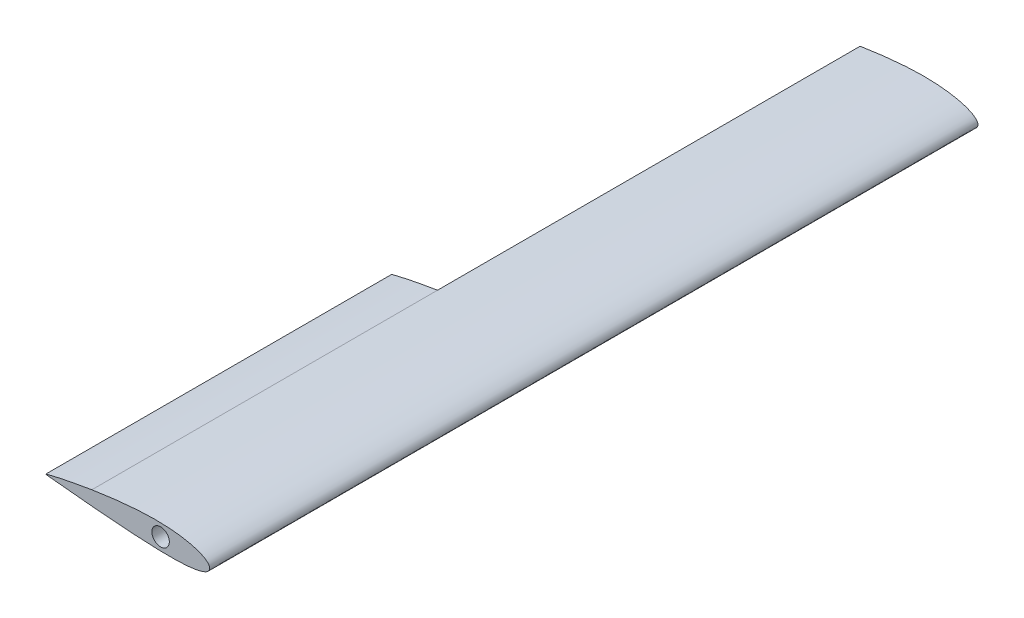
from build123d import *

# Parameters (mm, degrees)
BOSS_EXTRUDE1_DEPTH = 1120
BOSS_EXTRUDE2_DEPTH = 504
SKETCH3_R           = 12.7
CUT_EXTRUDE2_DEPTH  = 800


with BuildPart() as part:
    # Sketch1 → Boss-Extrude1 (new body)
    with BuildSketch(Plane.XY):
        with BuildLine():
            Line((-171.846, 13.802437795), (-171.846, -6.885945817))
            add(Edge.make_bspline(
                [(-171.846, 13.802437795), (-169.687195915, 14.146608219), (-164.597904491, 14.957975772), (-156.487198096, 16.142253603), (-147.460336343, 17.370404658), (-138.251119141, 18.509863587), (-128.91726091, 19.545491819), (-119.516780163, 20.457589719), (-110.108636731, 21.229014604), (-100.738687873, 21.842612064), (-91.448634267, 22.288155063), (-82.295790198, 22.495969861), (-73.354832572, 22.463929008), (-64.702828584, 22.18711462), (-56.397940477, 21.667769113), (-48.495875722, 20.912185856), (-41.049350171, 19.931395959), (-34.10749814, 18.740733947), (-27.715339735, 17.359414779), (-21.913282389, 15.809833244), (-16.73665061, 14.116648387), (-12.215187057, 12.305641332), (-8.372488395, 10.402139974), (-5.225239405, 8.428904048), (-2.783157587, 6.401540541), (-1.052244784, 4.322610537), (-0.056660018, 2.172493692), (0.129841681, -0.013040918), (-0.485118951, -2.116648366), (-1.873876517, -4.027820142), (-3.951712439, -5.73405902), (-6.693728323, -7.267300245), (-10.088688623, -8.637294366), (-14.120806225, -9.844419373), (-18.768065608, -10.885539045), (-24.003355548, -11.757837546), (-29.795659026, -12.460153718), (-36.110844654, -12.993800718), (-42.912190191, -13.362969431), (-50.160721884, -13.574922495), (-57.815433259, -13.639960871), (-65.833426064, -13.571253014), (-74.169986794, -13.384258056), (-82.778692186, -13.096889474), (-91.628583698, -12.725343858), (-100.6830751, -12.294655463), (-109.886493182, -11.766197657), (-119.166555289, -11.162114496), (-128.453974413, -10.498197235), (-137.692554642, -9.790268876), (-146.826066097, -9.052699068), (-155.798515887, -8.297745307), (-164.120854312, -7.576719647), (-169.445500495, -7.10059578), (-171.846, -6.885945817)],
                knots=[0, 0, 0, 0, 0.018424224, 0.043434346, 0.069080412, 0.095203092, 0.121640117, 0.148227444, 0.17480049, 0.201195447, 0.227363977, 0.253181792, 0.278347264, 0.302710399, 0.326128333, 0.348466602, 0.369600377, 0.389415723, 0.407811011, 0.424698681, 0.44000774, 0.453687637, 0.465714725, 0.476103672, 0.484928355, 0.492360154, 0.498730164, 0.504586951, 0.510443348, 0.516803825, 0.524198712, 0.532940661, 0.543185695, 0.554995644, 0.568376342, 0.583298542, 0.599709376, 0.617538825, 0.636703502, 0.65710892, 0.678650912, 0.701216586, 0.724685048, 0.748928058, 0.7738107, 0.799337901, 0.825325561, 0.851504471, 0.877716004, 0.903800001, 0.929595993, 0.954944401, 0.979687675, 1, 1, 1, 1], degree=3))
        make_face()
    extrude(amount=-BOSS_EXTRUDE1_DEPTH)

    # Sketch2 → Boss-Extrude2 (add)
    with BuildSketch(Plane.XY):
        with BuildLine():
            Line((-171.846, 13.802437795), (-171.846, -6.885945817))
            add(Edge.make_bspline(
                [(-171.846, -6.885945817), (-172.279902363, -6.847380871), (-175.440788036, -6.566443507), (-181.20260448, -6.039037107), (-188.990475627, -5.318490675), (-196.354667503, -4.624027661), (-203.248715472, -3.963662315), (-209.62869157, -3.342827921), (-215.45375872, -2.767227992), (-220.68642467, -2.242557883), (-225.292785955, -1.773651923), (-229.242958682, -1.367494105), (-232.510834877, -1.023880311), (-235.075678546, -0.760955177), (-236.918777596, -0.548714441), (-238.031628616, -0.459131063), (-238.533564191, -0.37457711), (-238.666663293, -0.375050863), (-238.675, -0.375080537)],
                knots=[0, 0, 0, 0, 0.019462551, 0.14178051, 0.258505433, 0.368899529, 0.472261554, 0.567931303, 0.655293986, 0.733784513, 0.802891701, 0.862162346, 0.911205133, 0.949694244, 0.977372582, 0.994054454, 0.999627599, 1, 1, 1, 1], degree=3))
            Line((-238.675, -0.375080537), (-238.675, 0.381187438))
            add(Edge.make_bspline(
                [(-171.846, 13.802437795), (-172.525257616, 13.696039939), (-175.933119288, 13.16223779), (-181.929700077, 12.142616472), (-189.692578637, 10.773435489), (-197.014829139, 9.410068419), (-203.853725709, 8.079803357), (-210.168184203, 6.800314366), (-215.920853202, 5.591321475), (-221.077844696, 4.471475693), (-225.608999658, 3.458736193), (-229.487989982, 2.569844783), (-232.692417395, 1.819938124), (-235.203893788, 1.222163617), (-237.008061317, 0.787162185), (-238.08635023, 0.525005253), (-238.562115977, 0.408767052), (-238.675, 0.381187438)],
                knots=[0, 0, 0, 0, 0.030251696, 0.151773928, 0.267626296, 0.377089872, 0.479484952, 0.574174897, 0.660569789, 0.738129949, 0.806369318, 0.864858701, 0.913228834, 0.951173208, 0.978450569, 0.994887008, 1, 1, 1, 1], degree=3))
        make_face()
    extrude(amount=-BOSS_EXTRUDE2_DEPTH)

    # Sketch3 → Cut-Extrude2 (cut)
    with BuildSketch(Plane.XY):
        with Locations((-71.603, 4.475)):
            Circle(SKETCH3_R)
    extrude(amount=-CUT_EXTRUDE2_DEPTH, mode=Mode.SUBTRACT)


solid = part.part
